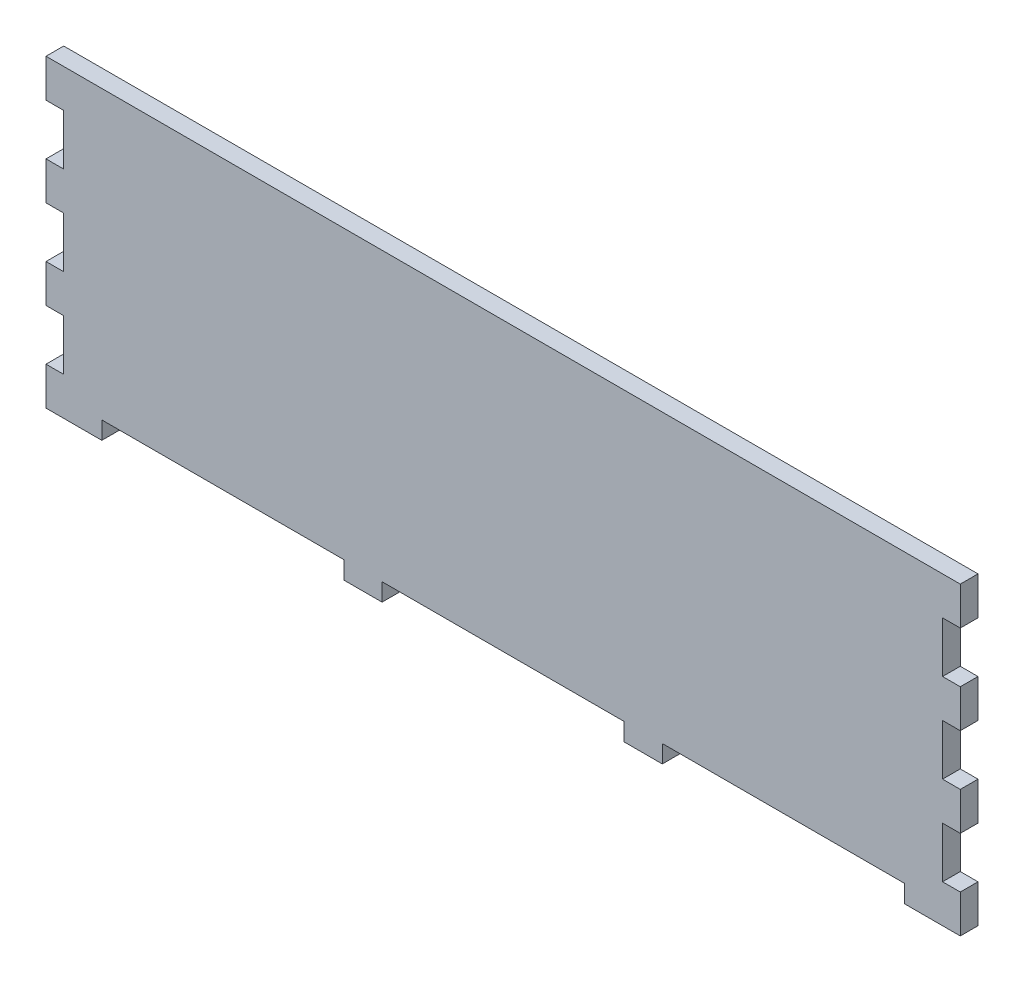
from build123d import *

# Parameters (mm, degrees)
BASE_SKETCH_W           = 585.98
BASE_SKETCH_H           = 191.39
BOSS_EXTRUDE1_DEPTH     = 11.81
JOINT_X_W               = 25.4
JOINT_X_H               = 11.81
BOSS_EXTRUDE2_DEPTH     = 11.81
LPATTERN1_COUNT         = 4
LPATTERN1_PITCH         = 186.86
JOINT_Y_W               = 11.81
JOINT_Y_H               = 25.4
BOSS_EXTRUDE3_DEPTH     = 11.81
LPATTERN2_COUNT         = 4
LPATTERN2_PITCH         = 59.266666667
MIRROR3_COPY_1_SKETCH_W = 11.81
MIRROR3_COPY_1_SKETCH_H = 25.4
MIRROR3_COPY_1_DEPTH    = 11.81
MIRROR3_COPY_2_SKETCH_W = 11.81
MIRROR3_COPY_2_SKETCH_H = 25.4
MIRROR3_COPY_2_DEPTH    = 11.81
MIRROR3_COPY_3_SKETCH_W = 11.81
MIRROR3_COPY_3_SKETCH_H = 25.4
MIRROR3_COPY_3_DEPTH    = 11.81


with BuildPart() as part:
    # Base_Sketch → Boss-Extrude1 (new body)
    with BuildSketch(Plane.XY):
        with Locations((0, -4.040082085)):
            Rectangle(BASE_SKETCH_W, BASE_SKETCH_H)
    extrude(amount=BOSS_EXTRUDE1_DEPTH)

    # Joint_X → Boss-Extrude2 (add)
    with BuildSketch(Plane.XY.offset(11.81)):
        with Locations((-280.29, -105.640082085)):
            Rectangle(JOINT_X_W, JOINT_X_H)
    boss_extrude2 = extrude(amount=-BOSS_EXTRUDE2_DEPTH)

    # LPattern1: Boss-Extrude2 ×4
    with Locations(*[(i * LPATTERN1_PITCH, 0, 0) for i in range(1, LPATTERN1_COUNT)]):
        add(boss_extrude2)

    # Joint_Y → Boss-Extrude3 (add)
    with BuildSketch(Plane.XY.offset(11.81)):
        with Locations((-298.895, -98.845082085)):
            Rectangle(JOINT_Y_W, JOINT_Y_H)
    boss_extrude3 = extrude(amount=-BOSS_EXTRUDE3_DEPTH)

    # LPattern2: Boss-Extrude3 ×4
    with Locations(*[(0, i * LPATTERN2_PITCH, 0) for i in range(1, LPATTERN2_COUNT)]):
        add(boss_extrude3)

    # Mirror3: Boss-Extrude3 across plane
    add(boss_extrude3.mirror(Plane.ZY))

    # Mirror3 copy 1 sketch → Mirror3 copy 1 (add)
    with BuildSketch(Plane(origin=(0, 59.266666667, 11.81), x_dir=(-1, 0, 0), z_dir=(0, 0, 1))):
        with Locations((-298.895, 98.845082085)):
            Rectangle(MIRROR3_COPY_1_SKETCH_W, MIRROR3_COPY_1_SKETCH_H)
    extrude(amount=-MIRROR3_COPY_1_DEPTH)

    # Mirror3 copy 2 sketch → Mirror3 copy 2 (add)
    with BuildSketch(Plane(origin=(0, 118.533333333, 11.81), x_dir=(-1, 0, 0), z_dir=(0, 0, 1))):
        with Locations((-298.895, 98.845082085)):
            Rectangle(MIRROR3_COPY_2_SKETCH_W, MIRROR3_COPY_2_SKETCH_H)
    extrude(amount=-MIRROR3_COPY_2_DEPTH)

    # Mirror3 copy 3 sketch → Mirror3 copy 3 (add)
    with BuildSketch(Plane(origin=(0, 177.8, 11.81), x_dir=(-1, 0, 0), z_dir=(0, 0, 1))):
        with Locations((-298.895, 98.845082085)):
            Rectangle(MIRROR3_COPY_3_SKETCH_W, MIRROR3_COPY_3_SKETCH_H)
    extrude(amount=-MIRROR3_COPY_3_DEPTH)


solid = part.part
